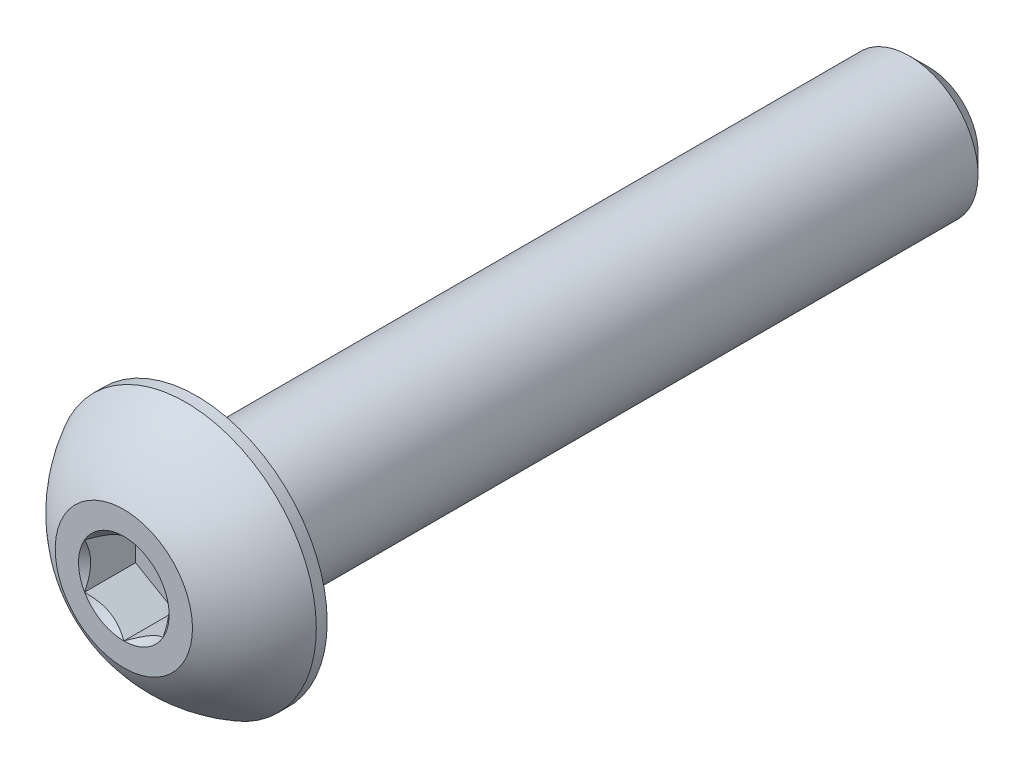
from build123d import *

# Parameters (mm, degrees)
SKETCH1_W          = 22.225
SKETCH1_H          = 2.0828
CHAMFER1_SIZE      = 0.5953125
CUT_EXTRUDE2_DEPTH = 1.54686


with BuildPart() as part:
    # Sketch1 → Revolve1 (revolve)
    with BuildSketch(Plane(origin=(0, 0, 0), x_dir=(0, 0, -1), z_dir=(1, 0, 0))):
        with Locations((13.3223, 1.0414)):
            Rectangle(SKETCH1_W, SKETCH1_H)
    revolve(axis=Axis((0, 0, -24.4348), (0, 0, 1)))

    # Chamfer1
    chamfer1_edges = [part.edges().sort_by_distance(p)[0] for p in [
        (0, -2.0828, -24.4348),
    ]]
    chamfer(chamfer1_edges, length=CHAMFER1_SIZE)

    # Sketch7 → Revolve2 (revolve)
    with BuildSketch(Plane(origin=(0, 0, 0), x_dir=(0, 0, -1), z_dir=(1, 0, 0)), mode=Mode.PRIVATE) as revolve2_sk:
        with BuildLine():
            Line((1.87833, 3.9624), (2.2098, 3.9624))
            Line((2.2098, 3.9624), (2.2098, 0))
            Line((2.2098, 0), (0, 0))
            Line((0, 0), (0, 2.0828))
            ThreePointArc((0, 2.0828), (0.796523813, 3.165144808), (1.87833, 3.9624))
        make_face()
    revolve(revolve2_sk.sketch.rotate(Axis((0, 0, 0), (0, 0, -1)), 180), axis=Axis((0, 0, 0), (0, 0, -1)))

    # Sketch5 → Cut-Extrude2 (cut)
    with BuildSketch(Plane.XY):
        Polygon((1.190625, -0.687407664), (1.190625, 0.687407664), (0, 1.374815329), (-1.190625, 0.687407664), (-1.190625, -0.687407664), (0, -1.374815329), align=None)
    extrude(amount=-CUT_EXTRUDE2_DEPTH, mode=Mode.SUBTRACT)

    # Cut-Extrude3 cone 1 section (through the dimple's axis) → Cut-Extrude3 (revolve, cut)
    with BuildSketch(Plane(origin=(0, 0, 0), x_dir=(0, -1, 0), z_dir=(1, 0, 0))):
        Polygon((0, 0), (1.374815329, 0), (0, 1.374815329), align=None)
    revolve(axis=Axis((0, 0, 0), (0, 0, -1)), mode=Mode.SUBTRACT)


solid = part.part
